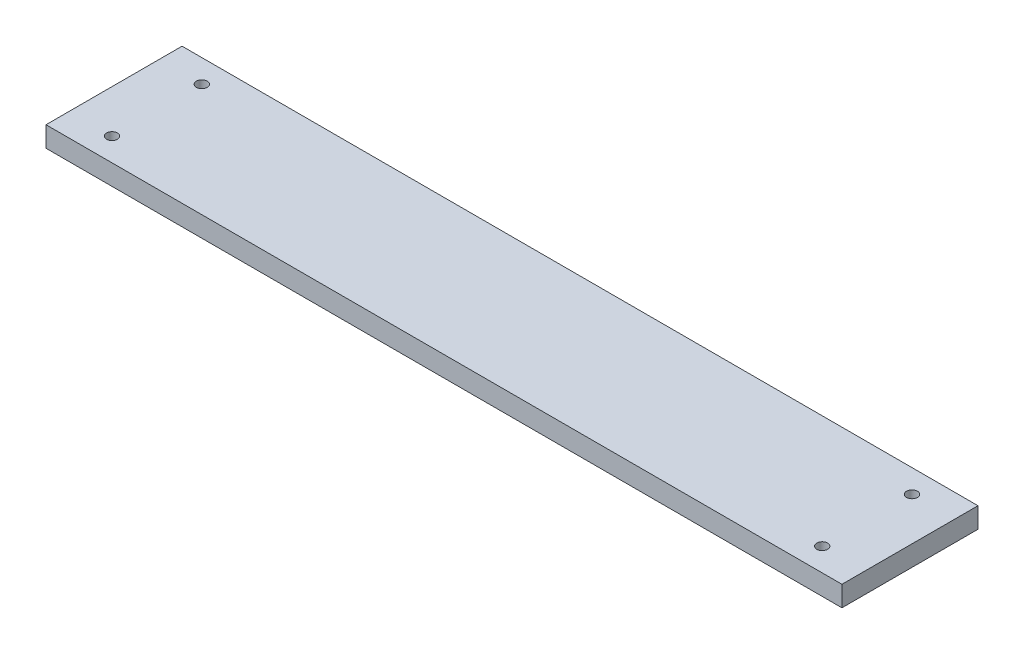
from build123d import *

# Parameters (mm, degrees)
CROQUIS1_W              = 585
CROQUIS1_H              = 100
CROQUIS1_R              = 4
SALIENTE_EXTRUIR1_DEPTH = 15
CROQUIS2_R              = 11
CORTAR_EXTRUIR1_DEPTH   = 7


with BuildPart() as part:
    # Croquis1 → Saliente-Extruir1 (new body)
    with BuildSketch(Plane(origin=(0, 0, 0), x_dir=(1, 0, 0), z_dir=(0, 1, 0))):
        with Locations((292.5, 50)):
            Rectangle(CROQUIS1_W, CROQUIS1_H)
        with Locations(Location((31.5, 83, 0), (0, 0, 270))):
            Circle(CROQUIS1_R, mode=Mode.SUBTRACT)
        with Locations(Location((31.5, 17, 0), (0, 0, 270))):
            Circle(CROQUIS1_R, mode=Mode.SUBTRACT)
        with Locations(Location((553.5, 17, 0), (0, 0, 90))):
            Circle(CROQUIS1_R, mode=Mode.SUBTRACT)
        with Locations(Location((553.5, 83, 0), (0, 0, 90))):
            Circle(CROQUIS1_R, mode=Mode.SUBTRACT)
    extrude(amount=SALIENTE_EXTRUIR1_DEPTH)

    # Croquis2 → Cortar-Extruir1 (cut)
    with BuildSketch(Plane.XZ):
        with Locations(Location((30.5, -50, 0), (0, 0, 270))):
            Circle(CROQUIS2_R)
        with Locations(Location((554.5, -50, 0), (0, 0, 90))):
            Circle(CROQUIS2_R)
    extrude(amount=-CORTAR_EXTRUIR1_DEPTH, mode=Mode.SUBTRACT)


solid = part.part
